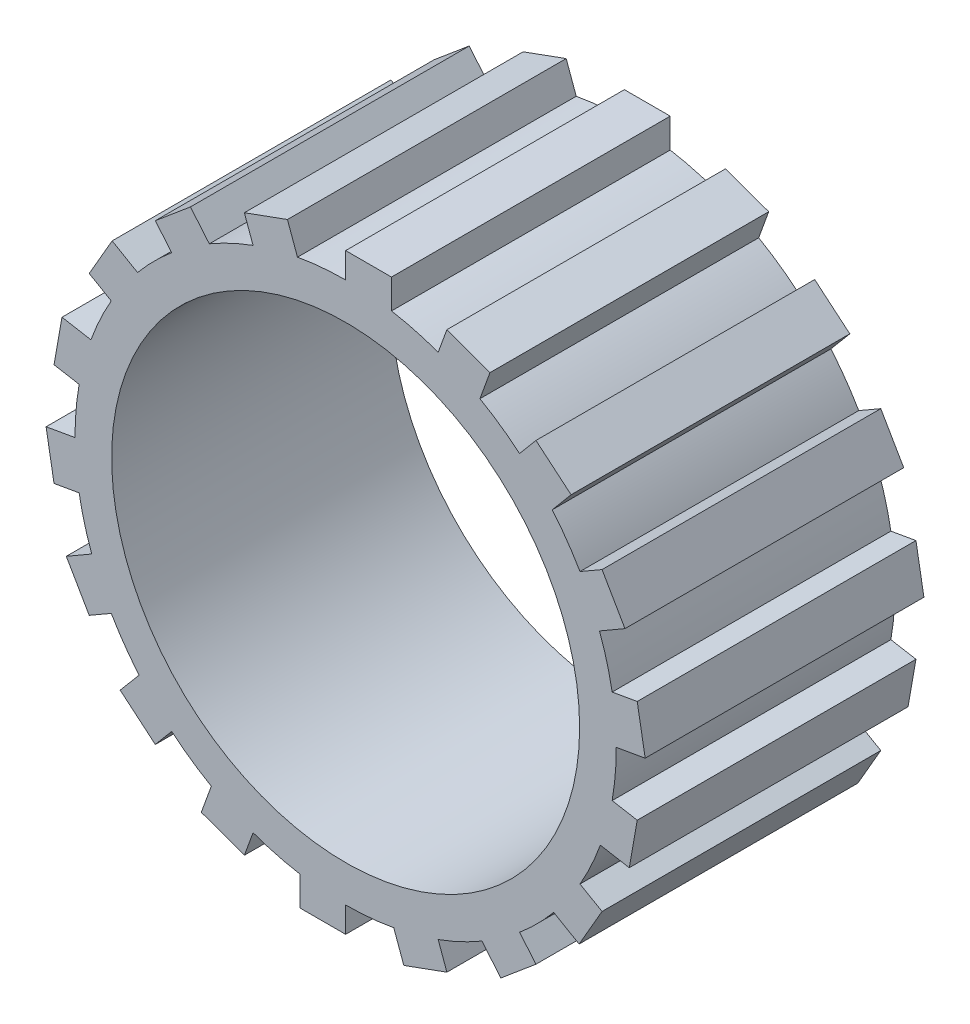
from build123d import *

# Parameters (mm, degrees)
SKETCH1_R           = 8.5
SKETCH1_R_2         = 7.35
BOSS_EXTRUDE3_DEPTH = 17.51
BOSS_EXTRUDE5_START = -0.3
SKETCH3_W           = 1.43994518
SKETCH3_H           = 8.755
BOSS_EXTRUDE5_DEPTH = 1.1
CIRPATTERN1_COUNT   = 18
SKETCH6_R           = 8.5
CUT_EXTRUDE1_DEPTH  = 8.755


with BuildPart() as part:
    # Sketch1 → Boss-Extrude3 (new body)
    with BuildSketch(Plane.XY):
        Circle(SKETCH1_R)
        Circle(SKETCH1_R_2, mode=Mode.SUBTRACT)
    extrude(amount=BOSS_EXTRUDE3_DEPTH)

    # Sketch3 → Boss-Extrude5 (add)
    with BuildSketch(Plane(origin=(0, 8.5, 0), x_dir=(1, 0, 0), z_dir=(0, 1, 0)).offset(BOSS_EXTRUDE5_START)):
        with Locations((0.71997259, -13.1325)):
            Rectangle(SKETCH3_W, SKETCH3_H)
    boss_extrude5 = extrude(amount=BOSS_EXTRUDE5_DEPTH)

    # CirPattern1: Boss-Extrude5 ×18 about axis
    cirpattern1_axis = Axis((0, 0, 0), (0, 0, 1))
    for i in range(1, CIRPATTERN1_COUNT):
        add(boss_extrude5.rotate(cirpattern1_axis, i * 360 / CIRPATTERN1_COUNT))

    # Sketch6 → Cut-Extrude1 (cut)
    with BuildSketch(Plane(origin=(0, 0, 0), x_dir=(-1, 0, 0), z_dir=(0, 0, -1))):
        Circle(SKETCH6_R)
    extrude(amount=-CUT_EXTRUDE1_DEPTH, mode=Mode.SUBTRACT)


solid = part.part
